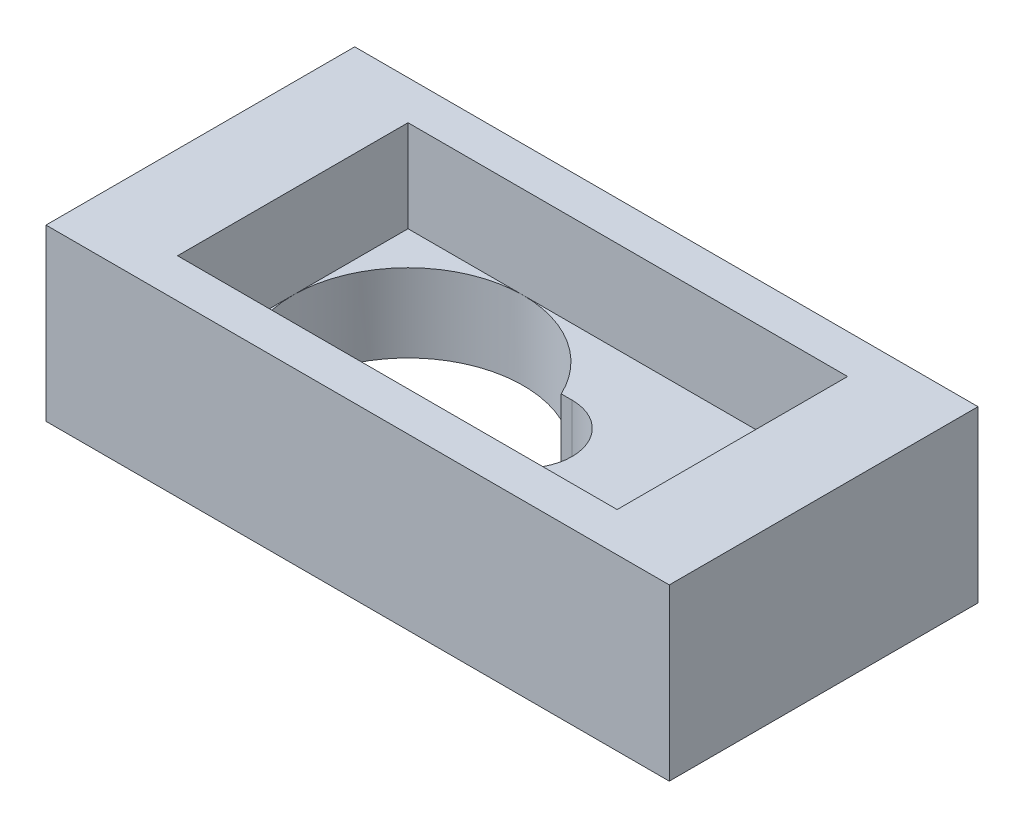
from build123d import *

# Parameters (mm, degrees)
BOSS_EXTRUDE5_DEPTH = 4
SKETCH8_W           = 31.9
SKETCH8_H           = 15.8
BOSS_EXTRUDE8_DEPTH = 4.7


with BuildPart() as part:
    # Sketch1 → Boss-Extrude5 (new body)
    with BuildSketch(Plane(origin=(0, 0, 0), x_dir=(1, 0, 0), z_dir=(0, 1, 0))):
        Polygon((-17.521212205, 5.796054243), (-17.521212205, -6.003945757), (-17.521212205, -8.003945757), (14.378787795, -8.003945757), (14.378787795, -6.003945757), (14.378787795, 5.796054243), (14.378787795, 7.796054243), (-17.521212205, 7.796054243), align=None)
        with BuildLine():
            Line((-0.998289948, -2.601375998), (-1.554401677, -2.601375998))
            ThreePointArc((-1.554401677, -2.601375998), (-12.793150429, -0.101375998), (-1.554401677, 2.398624002))
            Line((-1.554401677, 2.398624002), (-0.998289948, 2.398624002))
            ThreePointArc((-0.998289948, 2.398624002), (1.501710052, -0.101375998), (-0.998289948, -2.601375998))
        make_face(mode=Mode.SUBTRACT)
    extrude(amount=BOSS_EXTRUDE5_DEPTH)

    # Sketch8 → Boss-Extrude8 (add)
    with BuildSketch(Plane(origin=(0, 4, 0), x_dir=(1, 0, 0), z_dir=(0, 1, 0))):
        with Locations((-1.571212205, -0.103945757)):
            Rectangle(SKETCH8_W, SKETCH8_H)
        Polygon((-6.895720189, 5.796054243), (-12.793150429, 5.796054243), (-12.793150429, -0.101375998), (-12.793150429, -5.998806238), (-6.895720189, -5.998806238), (9.704279811, -5.998806238), (9.704279811, 5.796054243), align=None, mode=Mode.SUBTRACT)
    extrude(amount=BOSS_EXTRUDE8_DEPTH)


solid = part.part
